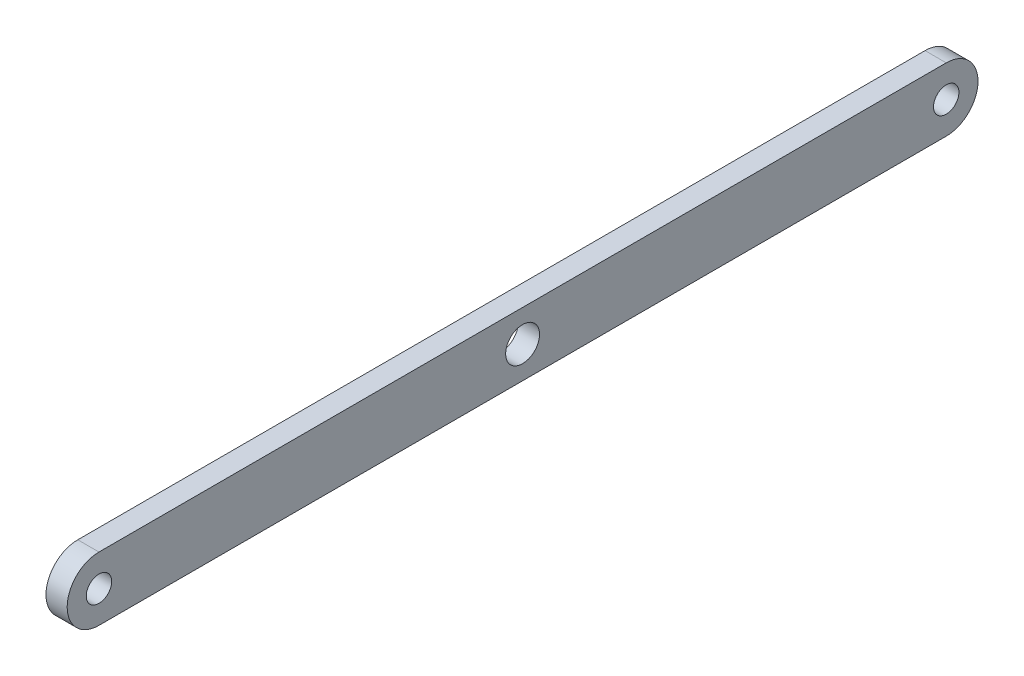
from build123d import *

# Parameters (mm, degrees)
SKETCH1_R           = 3
SKETCH1_R_2         = 4
BOSS_EXTRUDE1_DEPTH = 5


with BuildPart() as part:
    # Sketch1 → Boss-Extrude1 (new body)
    with BuildSketch(Plane(origin=(0, 0, 0), x_dir=(0, 0, -1), z_dir=(1, 0, 0))):
        with BuildLine():
            Line((100, 7.5), (-100, 7.5))
            ThreePointArc((-100, 7.5), (-107.5, 0), (-100, -7.5))
            Line((-100, -7.5), (100, -7.5))
            ThreePointArc((100, -7.5), (107.5, 0), (100, 7.5))
        make_face()
        with Locations((-100, 0)):
            Circle(SKETCH1_R, mode=Mode.SUBTRACT)
        Circle(SKETCH1_R_2, mode=Mode.SUBTRACT)
        with Locations((100, 0)):
            Circle(SKETCH1_R, mode=Mode.SUBTRACT)
    extrude(amount=BOSS_EXTRUDE1_DEPTH)


solid = part.part
